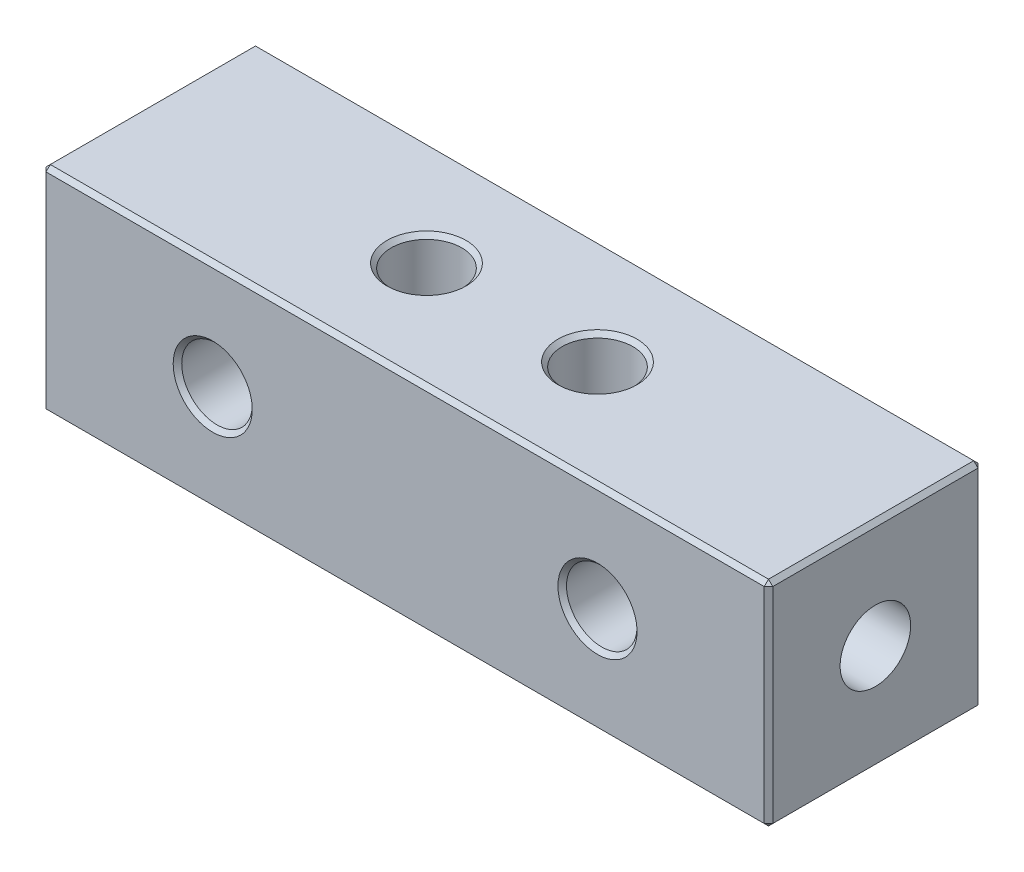
from build123d import *

# Parameters (mm, degrees)
SKETCH_1_W              = 34
SKETCH_1_H              = 10
EXTRUDE_1_DEPTH         = 5
HOLE_WIZARD_M4_1_D      = 3.3
HOLE_WIZARD_M4_2_D      = 3.3
CHAMFER_1_SIZE          = 0.2
HOLE_WIZARD_M4_3_REACH  = 36.728
HOLE_WIZARD_M4_3_BORE_R = 1.65
HOLE_WIZARD_M4_4_REACH  = 36.728
HOLE_WIZARD_M4_4_BORE_R = 1.65


with BuildPart() as part:
    # 草图1 → 凸台-拉伸1 (new, symmetric)
    with BuildSketch(Plane(origin=(0, 0, 0), x_dir=(1, 0, 0), z_dir=(0, 1, 0))):
        Rectangle(SKETCH_1_W, SKETCH_1_H)
    extrude(amount=EXTRUDE_1_DEPTH, both=True)

    # M4 螺纹孔1 (through all)
    with Locations(Plane(origin=(0, 5, 0), x_dir=(1, 0, 0), z_dir=(0, 1, 0))):
        with Locations((-4, 0), (4, 0)):
            Hole(HOLE_WIZARD_M4_1_D / 2)

    # M4 螺纹孔2 (through all)
    with Locations(Plane(origin=(0, 0, -5), x_dir=(-1, 0, 0), z_dir=(0, 0, -1))):
        with Locations((-9, 0), (9, 0)):
            Hole(HOLE_WIZARD_M4_2_D / 2)

    # 倒角1
    chamfer_1_edges = [part.edges().sort_by_distance(p)[0] for p in [
        (-17, 5, 0),
        (5.65, 5, 0),
        (5.65, -5, 0),
        (0, 5, 5),
        (-2.35, 5, 0),
        (-2.35, -5, 0),
        (-10.65, 0, -5),
        (-10.65, 0, 5),
        (7.35, 0, -5),
        (7.35, 0, 5),
        (17, 5, 0),
        (0, -5, 5),
        (-17, -5, 0),
        (0, -5, -5),
        (17, -5, 0),
        (17, 0, 5),
        (-17, 0, 5),
        (-17, 0, -5),
        (17, 0, -5),
        (0, 5, -5),
    ]]
    chamfer(chamfer_1_edges, length=CHAMFER_1_SIZE)

    # M4 螺纹孔3 bore → M4 螺纹孔3 (cut, up to next)
    with BuildSketch(Plane.ZY.offset(17), mode=Mode.PRIVATE) as hole_wizard_m4_3_sk1:
        Circle(HOLE_WIZARD_M4_3_BORE_R)
    hole_wizard_m4_3_tool1 = extrude(hole_wizard_m4_3_sk1.sketch, amount=-HOLE_WIZARD_M4_3_REACH, mode=Mode.PRIVATE) & part.part
    add(hole_wizard_m4_3_tool1.solids().sort_by_distance((-17, 0, 0))[0], mode=Mode.SUBTRACT)

    # M4 螺纹孔4 bore → M4 螺纹孔4 (cut, up to next)
    with BuildSketch(Plane(origin=(17, 0, 0), x_dir=(0, 0, -1), z_dir=(1, 0, 0)), mode=Mode.PRIVATE) as hole_wizard_m4_4_sk1:
        Circle(HOLE_WIZARD_M4_4_BORE_R)
    hole_wizard_m4_4_tool1 = extrude(hole_wizard_m4_4_sk1.sketch, amount=-HOLE_WIZARD_M4_4_REACH, mode=Mode.PRIVATE) & part.part
    add(hole_wizard_m4_4_tool1.solids().sort_by_distance((17, 0, 0))[0], mode=Mode.SUBTRACT)


solid = part.part
